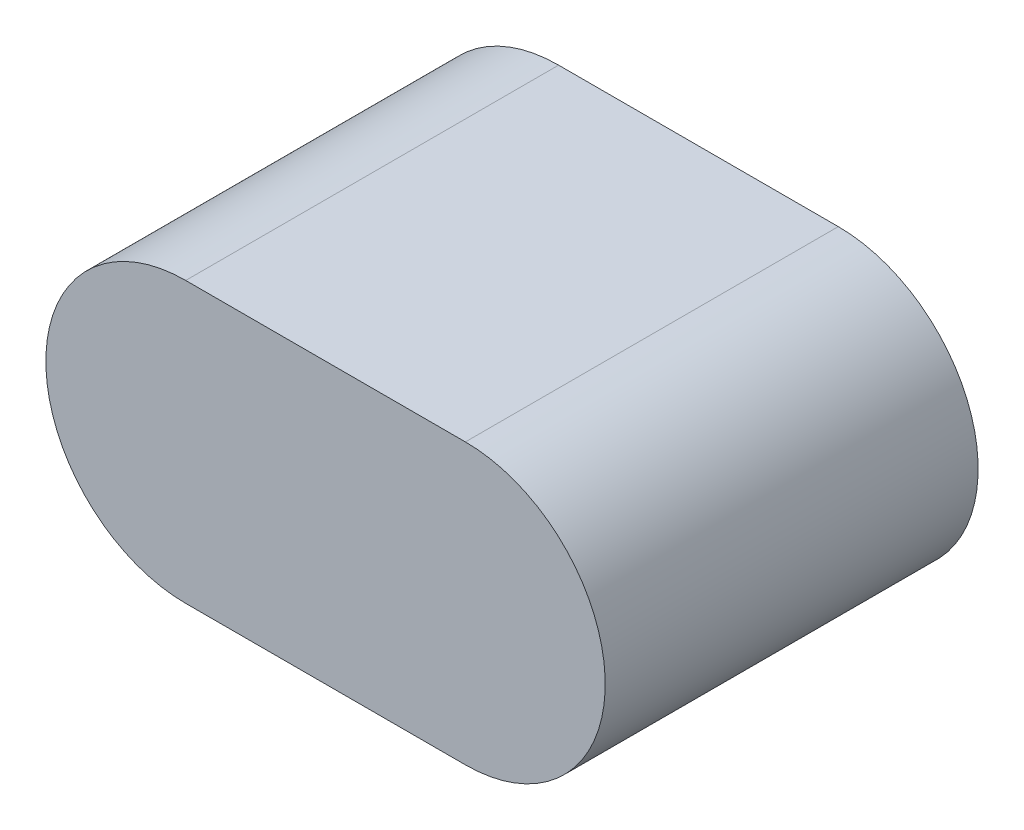
from build123d import *

# Parameters (mm, degrees)
EXTRUDE_1_DEPTH          = 75
EXTRUDE_1_DEPTH_BACK     = 75
SKETCH_1_W               = 300
SKETCH_1_H               = 200
CUT_EXTRUDE_2_DEPTH      = 196.256241898
CUT_EXTRUDE_2_DEPTH_BACK = 196.256241898
SKETCH_2_OUTSIDE_W       = 380.102
SKETCH_2_OUTSIDE_H       = 230.102


with BuildPart() as part:
    # 草图1 → 凸台-拉伸1 (new, two sides: drawn at the far end of the back side and taken through both)
    with BuildSketch(Plane(origin=(0, 0, 0), x_dir=(1, 0, 0), z_dir=(0, 1, 0)).offset(-EXTRUDE_1_DEPTH_BACK)):
        Rectangle(SKETCH_1_W, SKETCH_1_H)
    extrude(amount=EXTRUDE_1_DEPTH + EXTRUDE_1_DEPTH_BACK)

    # 草图2 outside → 切除-拉伸2 (cut, two sides: drawn at the far end of the back side and taken through both)
    with BuildSketch(Plane.XY.offset(-CUT_EXTRUDE_2_DEPTH_BACK)):
        Rectangle(SKETCH_2_OUTSIDE_W, SKETCH_2_OUTSIDE_H)
        with BuildLine():
            Line((-75, 75), (75, 75))
            ThreePointArc((75, 75), (150, 0), (75, -75))
            Line((75, -75), (-75, -75))
            ThreePointArc((-75, -75), (-150, 0), (-75, 75))
        make_face(mode=Mode.SUBTRACT)
    extrude(amount=CUT_EXTRUDE_2_DEPTH + CUT_EXTRUDE_2_DEPTH_BACK, mode=Mode.SUBTRACT)


solid = part.part
